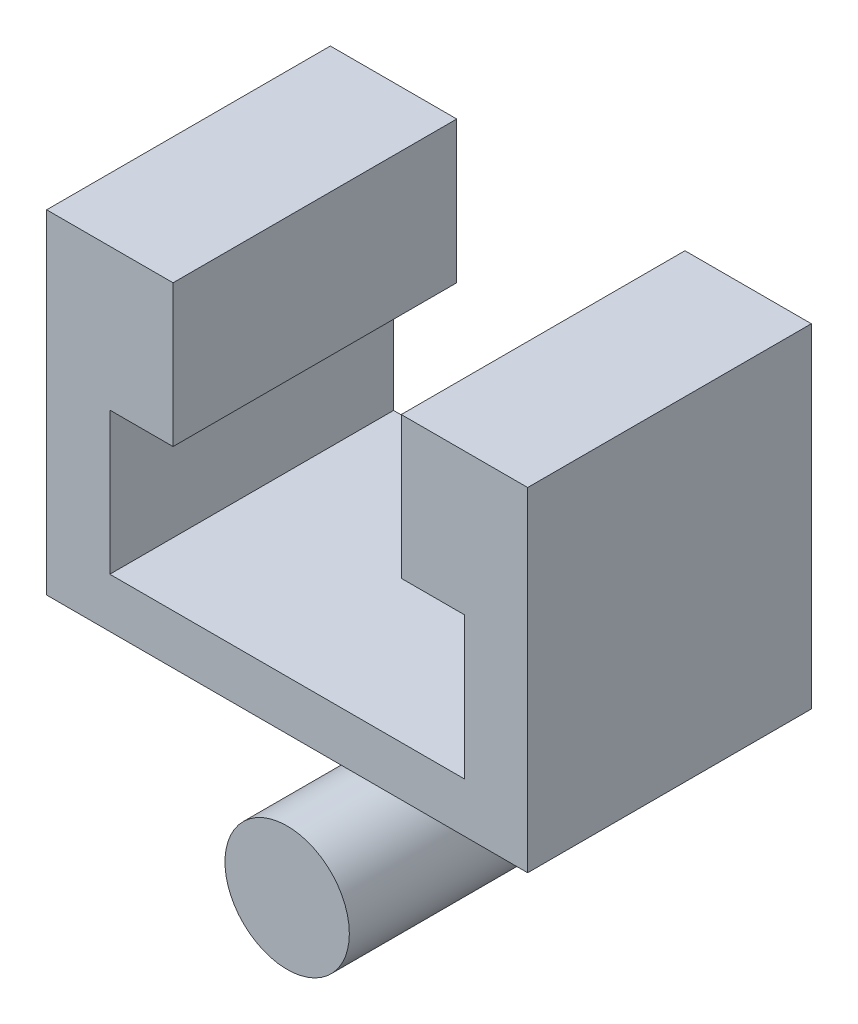
from build123d import *

# Parameters (mm, degrees)
BOSS_EXTRUDE1_DEPTH = 0.840608912
SKETCH2_R           = 11.136118556
BOSS_EXTRUDE2_DEPTH = 50.8
SKETCH3_W           = 86.137031446
SKETCH3_H           = 59.748072355
BOSS_EXTRUDE3_DEPTH = 50.8
CUT_EXTRUDE1_DEPTH  = 109.100560925


with BuildPart() as part:
    # Sketch1 → Boss-Extrude1 (new body)
    with BuildSketch(Plane.XY):
        with BuildLine():
            Line((-11.136118556, 0), (-11.136118556, 25.4))
            Line((-11.136118556, 25.4), (11.136118556, 25.4))
            Line((11.136118556, 25.4), (11.136118556, 0))
            ThreePointArc((11.136118556, 0), (0, 11.136118556), (-11.136118556, 0))
        make_face()
    extrude(amount=BOSS_EXTRUDE1_DEPTH)

    # Sketch2 → Boss-Extrude2 (add)
    with BuildSketch(Plane.XY):
        Circle(SKETCH2_R)
    extrude(amount=BOSS_EXTRUDE2_DEPTH)

    # Sketch3 → Boss-Extrude3 (add)
    with BuildSketch(Plane.XY):
        with Locations((0, 55.274036178)):
            Rectangle(SKETCH3_W, SKETCH3_H)
    extrude(amount=BOSS_EXTRUDE3_DEPTH)

    # Sketch4 → Cut-Extrude1 (cut, through all)
    with BuildSketch(Plane.XY.offset(50.8)):
        Polygon((20.431484277, 85.148072355), (20.431484277, 59.748072355), (31.75, 59.748072355), (31.75, 34.29), (-31.75, 34.29), (-31.75, 59.748072355), (-20.431484277, 59.748072355), (-20.431484277, 85.148072355), align=None)
    extrude(amount=-CUT_EXTRUDE1_DEPTH, mode=Mode.SUBTRACT)


solid = part.part
